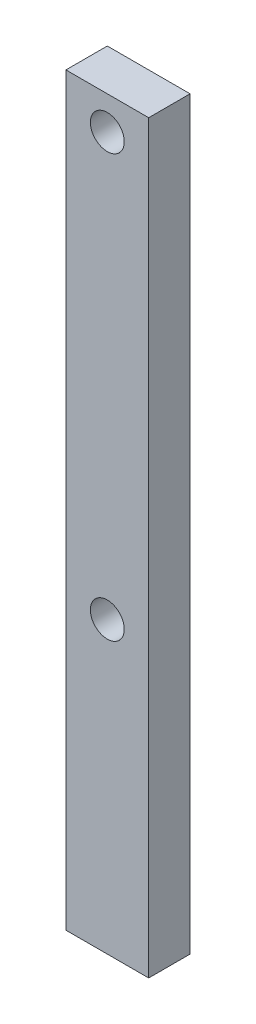
from build123d import *

# Parameters (mm, degrees)
ESQUISSE1_W             = 12.7
ESQUISSE1_H             = 114.3
BOSS_EXTRU_1_DEPTH      = 6.35
ESQUISSE3_R             = 2.6
ENL_V_MAT_EXTRU_2_DEPTH = 58.851253228


with BuildPart() as part:
    # Esquisse1 → Boss.-Extru.1 (new body)
    with BuildSketch(Plane.XY):
        Rectangle(ESQUISSE1_W, ESQUISSE1_H)
    extrude(amount=BOSS_EXTRU_1_DEPTH)

    # Esquisse3 → Enlèv. mat.-Extru.2 (cut, through all)
    with BuildSketch(Plane.XY.offset(6.35)):
        with Locations((0, -12.7)):
            Circle(ESQUISSE3_R)
        with Locations((0, 52.07)):
            Circle(ESQUISSE3_R)
    extrude(amount=-ENL_V_MAT_EXTRU_2_DEPTH, mode=Mode.SUBTRACT)


solid = part.part
